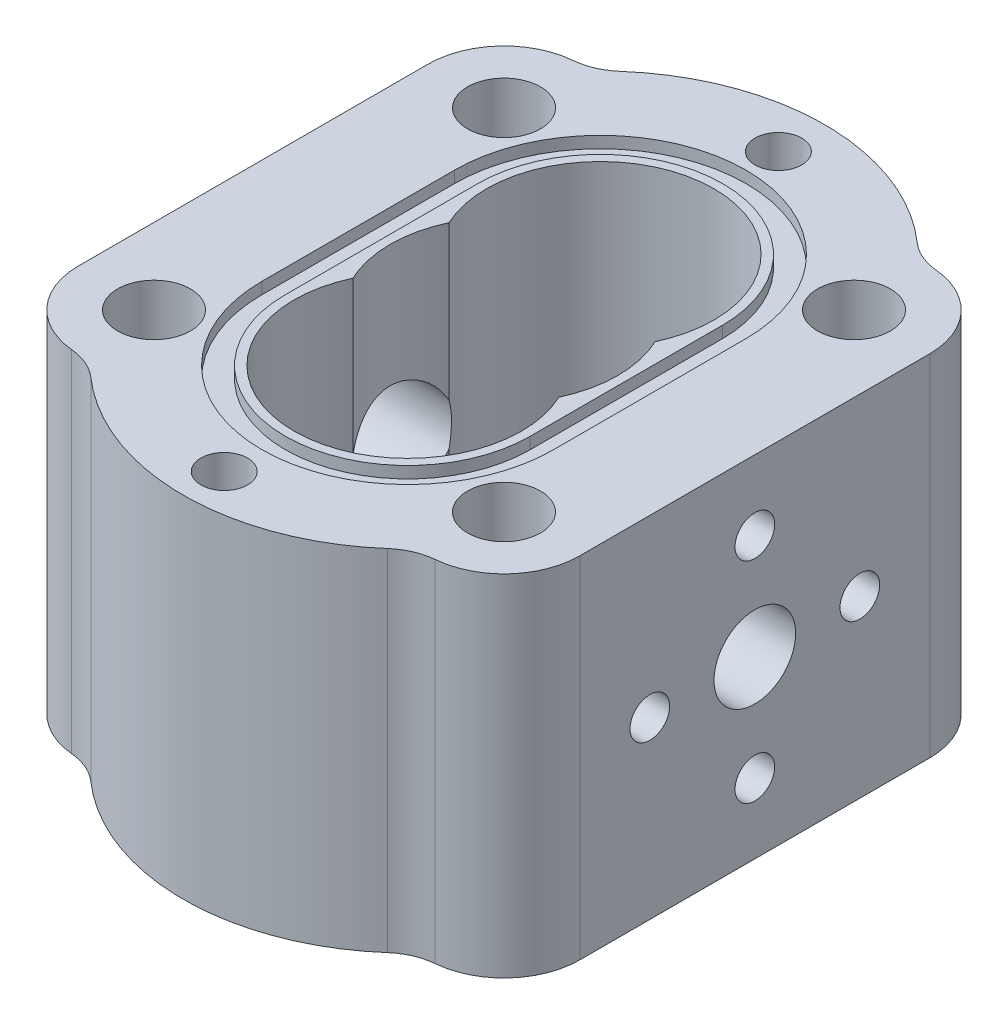
from build123d import *

# Parameters (mm, degrees)
EXTRUDE_1_DEPTH                 = 60
FILLET_1_R                      = 10
CUT_EXTRUDE_1_DEPTH             = 93.054331955
CUT_EXTRUDE_1_DEPTH_BACK        = 93.054331955
SKETCH_2_R                      = 6.25
CUT_EXTRUDE_2_DEPTH             = 93.054331955
CUT_EXTRUDE_2_DEPTH_BACK        = 93.054331955
SKETCH_3_R                      = 19.5
CUT_EXTRUDE_3_DEPTH             = 2
MM_1_D                          = 8
MM_1_DEPTH                      = 6
MM_1_TIP                        = 2.403442476
CUT_EXTRUDE_4_REACH             = 120.41
CUT_EXTRUDE_4_END_RADIUS        = 19.5
SKETCH_9_R                      = 7
CUT_EXTRUDE_4_DIRECTION_2_DEPTH = 119.410303775
CUT_EXTRUDE_5_REACH             = 120.41
SKETCH_10_R                     = 9
HOLE_WIZARD_M8_2_AT_2_COUNT     = 2
HOLE_WIZARD_M8_2_AT_2_PITCH     = 25.455844123
HOLE_WIZARD_M8_2_AT_3_COUNT     = 2
HOLE_WIZARD_M8_2_AT_3_PITCH     = 36
HOLE_WIZARD_M8_2_AT_4_COUNT     = 2
HOLE_WIZARD_M8_2_AT_4_PITCH     = 25.455844123


with BuildPart() as part:
    # 草图1 → 凸台-拉伸1 (new body)
    with BuildSketch(Plane(origin=(0, 0, 0), x_dir=(1, 0, 0), z_dir=(0, 1, 0))):
        with BuildLine():
            ThreePointArc((-38.5, 16.5), (-35.796358171, 30.672887556), (-28.065156277, 42.855208274))
            ThreePointArc((-28.065156277, 42.855208274), (-38.480773302, 39.852739934), (-43, 30))
            Line((-43, 30), (-43, -30))
            ThreePointArc((-43, -30), (-38.480773302, -39.852739934), (-28.065156277, -42.855208274))
            ThreePointArc((-28.065156277, -42.855208274), (-35.796358171, -30.672887556), (-38.5, -16.5))
            Line((-38.5, -16.5), (-38.5, 16.5))
        make_face()
        with BuildLine():
            ThreePointArc((-17, 30), (-20.147260066, 38.480773302), (-28.065156277, 42.855208274))
            ThreePointArc((-28.065156277, 42.855208274), (-35.796358171, 30.672887556), (-38.5, 16.5))
            Line((-38.5, 16.5), (-38.5, -16.5))
            ThreePointArc((-38.5, -16.5), (-35.796358171, -30.672887556), (-28.065156277, -42.855208274))
            ThreePointArc((-28.065156277, -42.855208274), (-20.147260066, -38.480773302), (-17, -30))
            Line((-17, -30), (-17, 30))
        make_face()
        with BuildLine():
            ThreePointArc((17, 30), (20.147260066, 38.480773302), (28.065156277, 42.855208274))
            ThreePointArc((28.065156277, 42.855208274), (0, 55), (-28.065156277, 42.855208274))
            ThreePointArc((-28.065156277, 42.855208274), (-20.147260066, 38.480773302), (-17, 30))
            Line((-17, 30), (-17, -30))
            ThreePointArc((-17, -30), (-20.147260066, -38.480773302), (-28.065156277, -42.855208274))
            ThreePointArc((-28.065156277, -42.855208274), (0, -55), (28.065156277, -42.855208274))
            ThreePointArc((28.065156277, -42.855208274), (20.147260066, -38.480773302), (17, -30))
            Line((17, -30), (17, 30))
        make_face()
        with BuildLine():
            Line((38.5, -16.5), (38.5, 16.5))
            ThreePointArc((38.5, 16.5), (35.796358171, 30.672887556), (28.065156277, 42.855208274))
            ThreePointArc((28.065156277, 42.855208274), (20.147260066, 38.480773302), (17, 30))
            Line((17, 30), (17, -30))
            ThreePointArc((17, -30), (20.147260066, -38.480773302), (28.065156277, -42.855208274))
            ThreePointArc((28.065156277, -42.855208274), (35.796358171, -30.672887556), (38.5, -16.5))
        make_face()
        with BuildLine():
            ThreePointArc((28.065156277, 42.855208274), (35.796358171, 30.672887556), (38.5, 16.5))
            Line((38.5, 16.5), (38.5, -16.5))
            ThreePointArc((38.5, -16.5), (35.796358171, -30.672887556), (28.065156277, -42.855208274))
            ThreePointArc((28.065156277, -42.855208274), (38.480773302, -39.852739934), (43, -30))
            Line((43, -30), (43, 30))
            ThreePointArc((43, 30), (38.480773302, 39.852739934), (28.065156277, 42.855208274))
        make_face()
    extrude(amount=EXTRUDE_1_DEPTH)

    # 圆角1
    fillet_1_edges = [part.edges().sort_by_distance(p)[0] for p in [
        (-28.065156277, 30, 42.855208274),
        (-28.065156277, 30, -42.855208274),
        (28.065156277, 30, -42.855208274),
        (28.065156277, 30, 42.855208274),
    ]]
    fillet(fillet_1_edges, radius=FILLET_1_R)

    # 草图2 → 切除-拉伸1 (cut, two sides: drawn at the far end of the back side and taken through both)
    with BuildSketch(Plane(origin=(0, 60, 0), x_dir=(1, 0, 0), z_dir=(0, 1, 0)).offset(-CUT_EXTRUDE_1_DEPTH_BACK)):
        with Locations(Location((-30, 30, 0), (0, 0, 270))):
            Circle(SKETCH_2_R)
        with Locations(Location((30, 30, 0), (0, 0, 270))):
            Circle(SKETCH_2_R)
        with Locations(Location((30, -30, 0), (0, 0, 270))):
            Circle(SKETCH_2_R)
        with Locations(Location((-30, -30, 0), (0, 0, 270))):
            Circle(SKETCH_2_R)
    extrude(amount=CUT_EXTRUDE_1_DEPTH + CUT_EXTRUDE_1_DEPTH_BACK, mode=Mode.SUBTRACT)

    # 草图3 → 切除-拉伸2 (cut, two sides: drawn at the far end of the back side and taken through both)
    with BuildSketch(Plane(origin=(0, 60, 0), x_dir=(1, 0, 0), z_dir=(0, 1, 0)).offset(-CUT_EXTRUDE_2_DEPTH_BACK)):
        with Locations((0, 16.5)):
            Circle(SKETCH_3_R)
        with Locations((0, -16.5)):
            Circle(SKETCH_3_R)
        Circle(SKETCH_3_R)
    extrude(amount=CUT_EXTRUDE_2_DEPTH + CUT_EXTRUDE_2_DEPTH_BACK, mode=Mode.SUBTRACT)

    # 草图4 → 切除-拉伸3 (cut)
    with BuildSketch(Plane(origin=(0, 60, 0), x_dir=(1, 0, 0), z_dir=(0, 1, 0))):
        with BuildLine():
            Line((25, 16.5), (25, -16.5))
            ThreePointArc((25, -16.5), (0, -41.5), (-25, -16.5))
            Line((-25, -16.5), (-25, 16.5))
            ThreePointArc((-25, 16.5), (0, 41.5), (25, 16.5))
        make_face()
        with BuildLine():
            Line((21, 16.5), (21, -16.5))
            ThreePointArc((21, -16.5), (0, -37.5), (-21, -16.5))
            Line((-21, -16.5), (-21, 16.5))
            ThreePointArc((-21, 16.5), (0, 37.5), (21, 16.5))
        make_face(mode=Mode.SUBTRACT)
    cut_extrude_3 = extrude(amount=-CUT_EXTRUDE_3_DEPTH, mode=Mode.SUBTRACT)

    # 镜向1: 切除-拉伸3 across plane
    add(cut_extrude_3.mirror(Plane.ZX.offset(30)), mode=Mode.SUBTRACT)

    # 大小mm 暗销孔1
    with Locations(Plane(origin=(0, 60, -47.035270406), x_dir=(0, 0, 1), z_dir=(0, 1, 0))):
        with Locations((0, 0), (95, 0)):
            Hole(MM_1_D / 2, depth=MM_1_DEPTH)
            with Locations((0, 0, -(MM_1_DEPTH + MM_1_TIP / 2))):  # 118° drill point
                Cone(0, MM_1_D / 2, MM_1_TIP, mode=Mode.SUBTRACT)

    # 切除-拉伸4: up to this cylinder (the profile starts outside it)
    cut_extrude_4_end = Plane(origin=(0, 30, 0), z_dir=(0, 1, 0)) * Cylinder(CUT_EXTRUDE_4_END_RADIUS, 280.82, mode=Mode.PRIVATE)
    # 草图9 → 切除-拉伸4 (cut, up to the surface)
    with BuildSketch(Plane(origin=(43, 0, 0), x_dir=(0, 0, -1), z_dir=(1, 0, 0)), mode=Mode.PRIVATE) as cut_extrude_4_sk1:
        with Locations(Location((0, 30, 0), (0, 0, 180))):
            Circle(SKETCH_9_R)
    cut_extrude_4_tool1 = extrude(cut_extrude_4_sk1.sketch, amount=-CUT_EXTRUDE_4_REACH, mode=Mode.PRIVATE) - cut_extrude_4_end
    add(cut_extrude_4_tool1.solids().sort_by_distance((43, 30, 0))[0], mode=Mode.SUBTRACT)

    # 草图9 → 切除-拉伸4 direction 2 (cut)
    with BuildSketch(Plane(origin=(43, 0, 0), x_dir=(0, 0, -1), z_dir=(1, 0, 0))):
        with Locations(Location((0, 30, 0), (0, 0, 180))):
            Circle(SKETCH_9_R)
    extrude(amount=CUT_EXTRUDE_4_DIRECTION_2_DEPTH, mode=Mode.SUBTRACT)

    # 草图10 → 切除-拉伸5 (cut, up to next)
    with BuildSketch(Plane.ZY.offset(43), mode=Mode.PRIVATE) as cut_extrude_5_sk1:
        with Locations((0, 30)):
            Circle(SKETCH_10_R)
    cut_extrude_5_tool1 = extrude(cut_extrude_5_sk1.sketch, amount=-CUT_EXTRUDE_5_REACH, mode=Mode.PRIVATE) & part.part
    add(cut_extrude_5_tool1.solids().sort_by_distance((-43, 30, 0))[0], mode=Mode.SUBTRACT)

    # 草图13 → M8 螺纹孔2 (revolve, cut)
    with BuildSketch(Plane(origin=(43, 48, 0), x_dir=(0, 0, -1), z_dir=(0, 1, 0))):
        Polygon((0, 0), (0, 17.042926105), (3.4, 15), (3.4, 0), align=None)
    hole_wizard_m8_2 = revolve(axis=Axis((49.35, 48, 0), (-1, 0, 0)), mode=Mode.SUBTRACT)

    # M8 螺纹孔2 at 2: M8 螺纹孔2 ×2
    with Locations(*[Vector(0, -0.7071067811865476, -0.7071067811865476) * (i * HOLE_WIZARD_M8_2_AT_2_PITCH) for i in range(1, HOLE_WIZARD_M8_2_AT_2_COUNT)]):
        add(hole_wizard_m8_2, mode=Mode.SUBTRACT)

    # M8 螺纹孔2 at 3: M8 螺纹孔2 ×2
    with Locations(*[(0, -i * HOLE_WIZARD_M8_2_AT_3_PITCH, 0) for i in range(1, HOLE_WIZARD_M8_2_AT_3_COUNT)]):
        add(hole_wizard_m8_2, mode=Mode.SUBTRACT)

    # M8 螺纹孔2 at 4: M8 螺纹孔2 ×2
    with Locations(*[Vector(0, -0.7071067811865475, 0.7071067811865476) * (i * HOLE_WIZARD_M8_2_AT_4_PITCH) for i in range(1, HOLE_WIZARD_M8_2_AT_4_COUNT)]):
        add(hole_wizard_m8_2, mode=Mode.SUBTRACT)

    # 镜向2: M8 螺纹孔2 across plane
    add(hole_wizard_m8_2.mirror(Plane(origin=(0, 0, 0), x_dir=(0, 0, 1), z_dir=(1, 0, 0))), mode=Mode.SUBTRACT)

    # 镜向2 copy 1 sketch → 镜向2 copy 1 (revolve, cut)
    with BuildSketch(Plane(origin=(-43, 30, -18), x_dir=(0, 0, -1), z_dir=(0, 1, 0))):
        Polygon((0, 0), (0, -17.042926105), (3.4, -15), (3.4, 0), align=None)
    revolve(axis=Axis((-49.35, 30, -18), (-1, 0, 0)), mode=Mode.SUBTRACT)

    # 镜向2 copy 2 sketch → 镜向2 copy 2 (revolve, cut)
    with BuildSketch(Plane(origin=(-43, 12, 0), x_dir=(0, 0, -1), z_dir=(0, 1, 0))):
        Polygon((0, 0), (0, -17.042926105), (3.4, -15), (3.4, 0), align=None)
    revolve(axis=Axis((-49.35, 12, 0), (-1, 0, 0)), mode=Mode.SUBTRACT)

    # 镜向2 copy 3 sketch → 镜向2 copy 3 (revolve, cut)
    with BuildSketch(Plane(origin=(-43, 30, 18), x_dir=(0, 0, -1), z_dir=(0, 1, 0))):
        Polygon((0, 0), (0, -17.042926105), (3.4, -15), (3.4, 0), align=None)
    revolve(axis=Axis((-49.35, 30, 18), (-1, 0, 0)), mode=Mode.SUBTRACT)


solid = part.part
